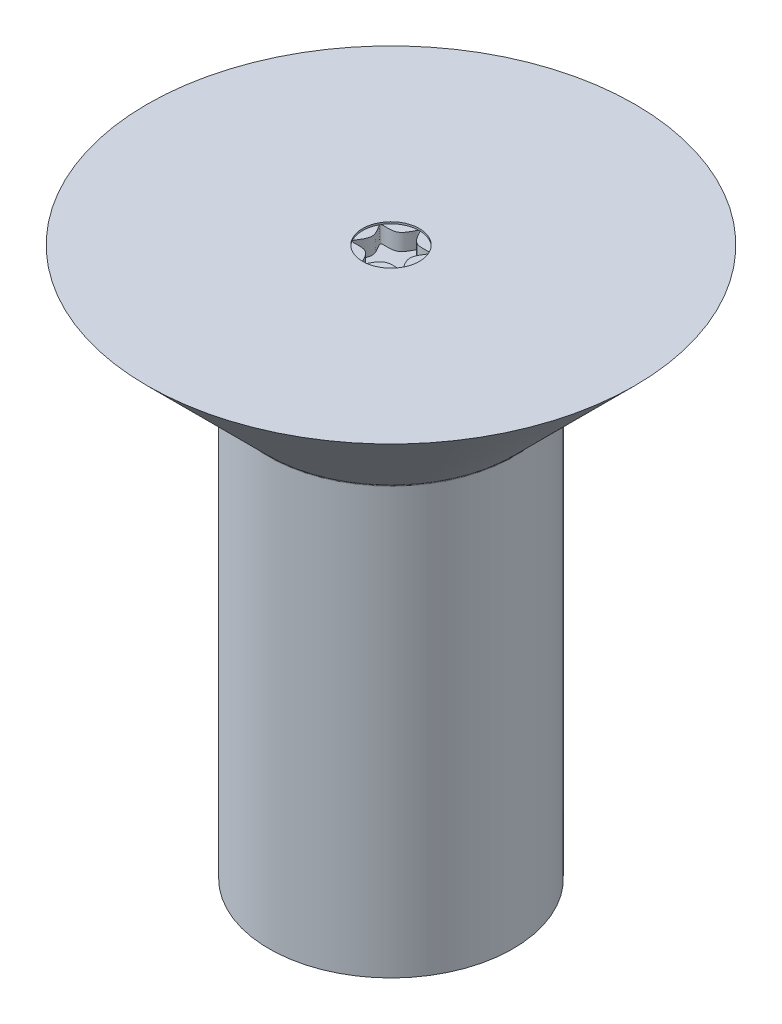
from build123d import *

# Parameters (mm, degrees)
RECESS_CUT_EXTRUDE1_DEPTH = 0.91
SKETCH3_R                 = 1.4
RECESS_CUT_EXTRUDE2_DEPTH = 0.091
FILLET1_R                 = 0.1


with BuildPart() as part:
    # Sketch1 → Body-Revolve (revolve)
    with BuildSketch(Plane.XY, mode=Mode.PRIVATE) as body_revolve_sk:
        Polygon((0, 27), (12, 27), (6, 21), (6, 0), (0, 0), align=None)
    revolve(body_revolve_sk.sketch.rotate(Axis((0, 0, 0), (0, 1, 0)), 90), axis=Axis((0, 0, 0), (0, 1, 0)))

    # Sketch2 → Recess-Cut-Extrude1 (cut)
    with BuildSketch(Plane(origin=(0, 27, 0), x_dir=(-1, 0, 0), z_dir=(0, 1, 0))):
        with BuildLine():
            add(Edge.make_bspline(
                [(0, -1.4), (-0.100650939, -1.4), (-0.301952816, -0.522997619), (-1.592188736, -0.919250595), (-0.603905632, 0), (-1.592188736, 0.919250595), (-0.301952816, 0.522997619), (0, 1.838501191), (0.301952816, 0.522997619), (1.592188736, 0.919250595), (0.603905632, 0), (1.592188736, -0.919250595), (0.301952816, -0.522997619), (0.100650939, -1.4), (0, -1.4)],
                knots=[0, 0, 0, 0, 0.083333333, 0.166666667, 0.25, 0.333333333, 0.416666667, 0.5, 0.583333333, 0.666666667, 0.75, 0.833333333, 0.916666667, 1, 1, 1, 1], degree=3))
        make_face()
    extrude(amount=-RECESS_CUT_EXTRUDE1_DEPTH, mode=Mode.SUBTRACT)

    # Sketch3 → Recess-Cut-Extrude2 (cut)
    with BuildSketch(Plane(origin=(0, 27, 0), x_dir=(-1, 0, 0), z_dir=(0, 1, 0))):
        with Locations(Location((0, 0, 0), (0, 0, 90))):
            Circle(SKETCH3_R)
    extrude(amount=-RECESS_CUT_EXTRUDE2_DEPTH, mode=Mode.SUBTRACT)

    # Sketch4 → Drill-Cut-Revolve (revolve, cut)
    with BuildSketch(Plane(origin=(4.79994809, 0, 0), x_dir=(1, 0, 0), z_dir=(0, 0, 1)), mode=Mode.PRIVATE) as drill_cut_revolve_sk:
        Polygon((0, 26.09), (0.933333333, 26.09), (0, 21.6), align=None)
    revolve(drill_cut_revolve_sk.sketch.rotate(Axis((0, 0, 0), (0, 1, 0)), 90), axis=Axis((0, 0, 0), (0, 1, 0)), mode=Mode.SUBTRACT)

    # Fillet1
    fillet1_edges = [part.edges().sort_by_distance(p)[0] for p in [
        (0, 21, 6),
    ]]
    fillet(fillet1_edges, radius=FILLET1_R)


solid = part.part
